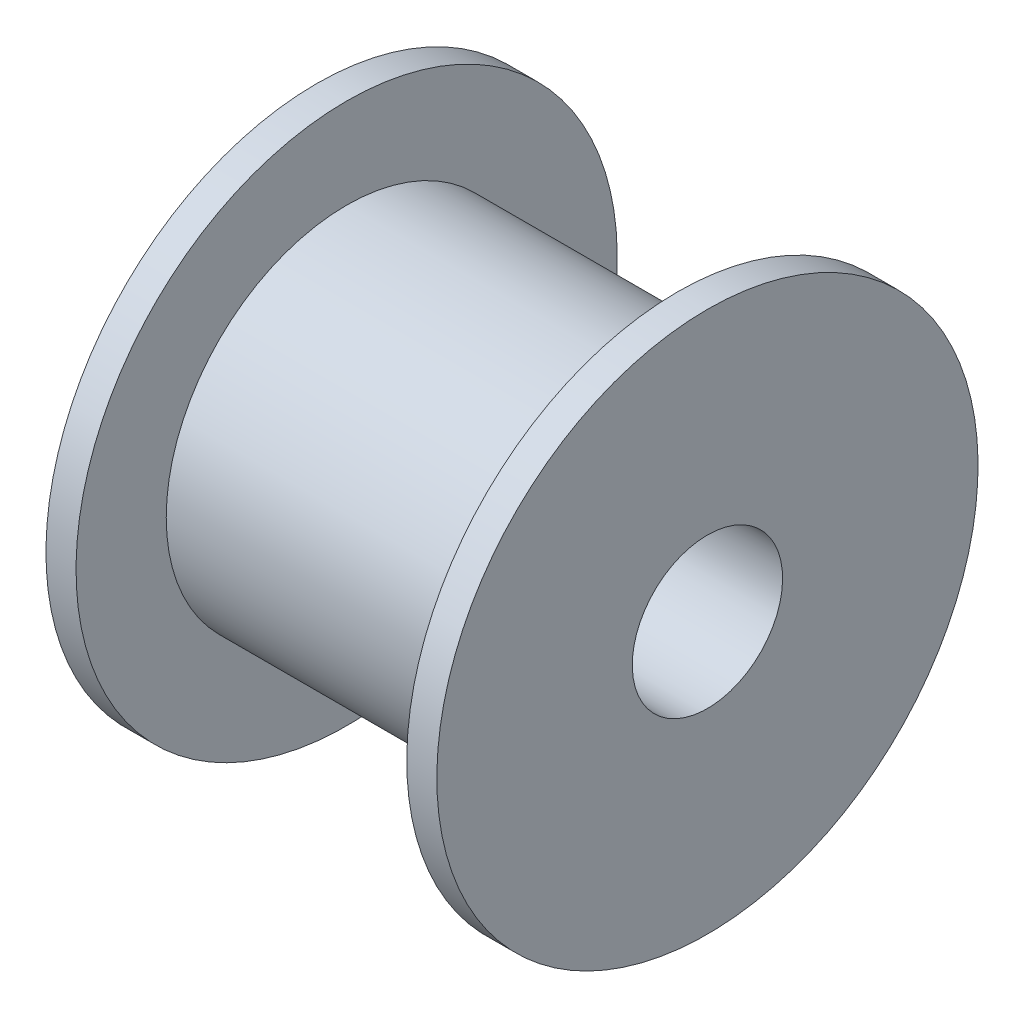
from build123d import *


with BuildPart() as part:
    # Эскиз2 → Повернуть1 (revolve)
    with BuildSketch(Plane.XY):
        Polygon((-13, 2.5), (0, 2.5), (0, 9), (-1, 9), (-1, 6), (-12, 6), (-12, 9), (-13, 9), align=None)
    revolve(axis=Axis((0, 0, 0), (-1, 0, 0)))


solid = part.part
